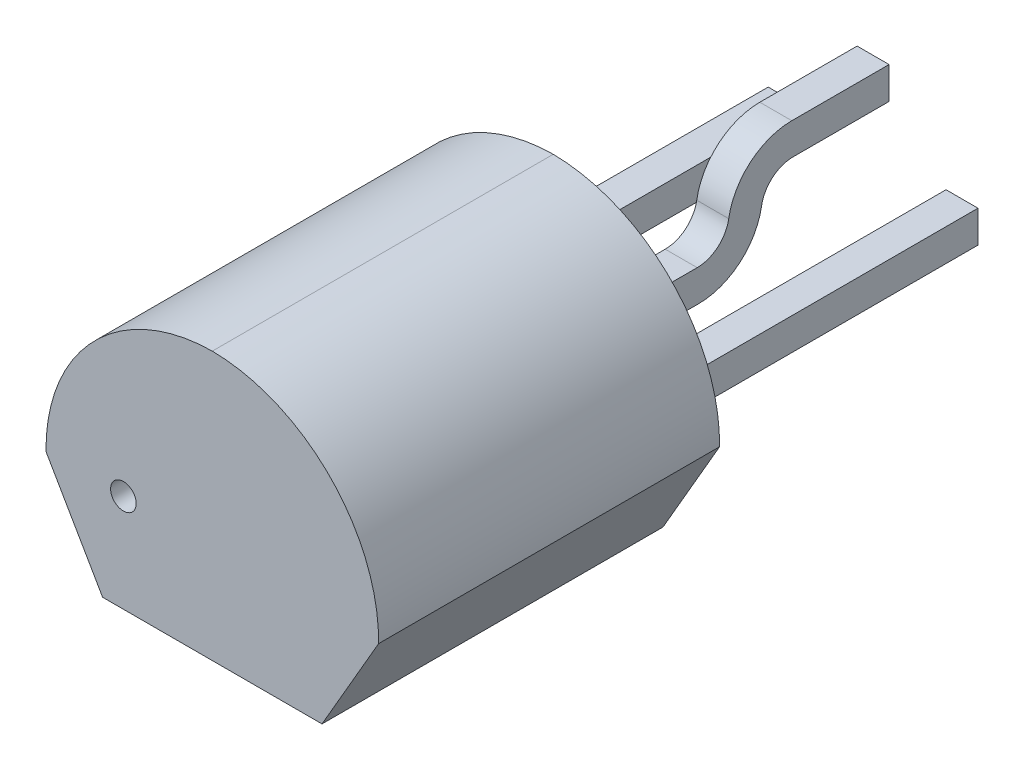
from build123d import *

# Parameters (mm, degrees)
EXTRUDE_1_DEPTH          = 5.33
SKETCH_1_W               = 0.5
SKETCH_1_H               = 0.5
EXTRUDE_2_DEPTH          = 2.54
SKETCH_1_2_W             = 0.5
SKETCH_1_2_H             = 0.5
EXTRUDE_3_DEPTH          = 10.16
SKETCH_4_R               = 0.2
CUT_EXTRUDE_1_DEPTH      = 0.5
SKETCH_5_W               = 0.5
SKETCH_5_H               = 10.2
EXTRUDE_4_DEPTH          = 1.25
CUT_EXTRUDE_2_DEPTH      = 10
CUT_EXTRUDE_2_DEPTH_BACK = 10
FILLET_1_R               = 0.5
FILLET_2_R               = 1
SKETCH_7_W               = 0.5
SKETCH_7_H               = 0.75
CUT_EXTRUDE_3_DEPTH      = 2
FILLET_3_R               = 1


with BuildPart() as part:
    # Эскиз3 → Вытянуть1 (new body)
    with BuildSketch(Plane.XY.offset(2.54)):
        with BuildLine():
            Line((-0.325, -1.53), (3.105, -1.53))
            Line((3.105, -1.53), (3.99, 0))
            ThreePointArc((3.99, 0), (3.240904038, 1.868477631), (1.39, 2.66))
            ThreePointArc((1.39, 2.66), (-0.460904038, 1.868477631), (-1.21, 0))
            Line((-1.21, 0), (-0.325, -1.53))
        make_face()
    extrude(amount=EXTRUDE_1_DEPTH)

    # Эскиз1 → Вытянуть2 (add)
    with BuildSketch(Plane.XY):
        with Locations((1.39, 0)):
            Rectangle(SKETCH_1_W, SKETCH_1_H)
        Rectangle(SKETCH_1_W, SKETCH_1_H)
        with Locations((2.78, 0)):
            Rectangle(SKETCH_1_W, SKETCH_1_H)
    extrude(amount=EXTRUDE_2_DEPTH)

    # Эскиз1<2> → Вытянуть3 (add)
    with BuildSketch(Plane.XY):
        with Locations((1.39, 0)):
            Rectangle(SKETCH_1_2_W, SKETCH_1_2_H)
        Rectangle(SKETCH_1_2_W, SKETCH_1_2_H)
        with Locations((2.78, 0)):
            Rectangle(SKETCH_1_2_W, SKETCH_1_2_H)
    extrude(amount=-EXTRUDE_3_DEPTH)

    # Эскиз4 → Вырез-Вытянуть1 (cut)
    with BuildSketch(Plane.XY.offset(7.87)):
        Circle(SKETCH_4_R)
    extrude(amount=-CUT_EXTRUDE_1_DEPTH, mode=Mode.SUBTRACT)

    # Эскиз5 → Вытянуть4 (add)
    with BuildSketch(Plane(origin=(0, 0.25, 0), x_dir=(1, 0, 0), z_dir=(0, 1, 0))):
        with Locations((1.39, 5.06)):
            Rectangle(SKETCH_5_W, SKETCH_5_H)
    extrude(amount=EXTRUDE_4_DEPTH)

    # Эскиз6 → Вырез-Вытянуть2 (cut, two sides: drawn at the far end of the back side and taken through both)
    with BuildSketch(Plane(origin=(1.64, 0, 0), x_dir=(0, 0, -1), z_dir=(1, 0, 0)).offset(-CUT_EXTRUDE_2_DEPTH_BACK)):
        with BuildLine():
            Line((2.46, -0.83850211), (10.787068804, -0.83850211))
            Line((10.787068804, -0.83850211), (10.787068804, 1))
            Line((10.787068804, 1), (10.787068804, 2.286855948))
            Line((10.787068804, 2.286855948), (2.46, 2.286855948))
            Line((2.46, 2.286855948), (2.46, 1))
            Line((2.46, 1), (0.96, 1))
            ThreePointArc((0.96, 1), (0.606446609, 0.853553391), (0.46, 0.5))
            Line((0.46, 0.5), (2.46, 0.5))
            Line((2.46, 0.5), (2.46, -0.83850211))
        make_face()
    extrude(amount=CUT_EXTRUDE_2_DEPTH + CUT_EXTRUDE_2_DEPTH_BACK, mode=Mode.SUBTRACT)

    # Скругление1
    fillet_1_edges = [part.edges().sort_by_distance(p)[0] for p in [
        (1.39, 0.25, 0.04),
    ]]
    fillet(fillet_1_edges, radius=FILLET_1_R)

    # Скругление2
    fillet_2_edges = [part.edges().sort_by_distance(p)[0] for p in [
        (1.39, 1.5, 0.04),
    ]]
    fillet(fillet_2_edges, radius=FILLET_2_R)

    # Эскиз7 → Вырез-Вытянуть3 (cut)
    with BuildSketch(Plane(origin=(0, 0, -2.46), x_dir=(-1, 0, 0), z_dir=(0, 0, -1))):
        with Locations((-1.39, 0.125)):
            Rectangle(SKETCH_7_W, SKETCH_7_H)
    extrude(amount=-CUT_EXTRUDE_3_DEPTH, mode=Mode.SUBTRACT)

    # Скругление3
    fillet_3_edges = [part.edges().sort_by_distance(p)[0] for p in [
        (1.39, -0.25, -0.46),
    ]]
    fillet(fillet_3_edges, radius=FILLET_3_R)


solid = part.part
